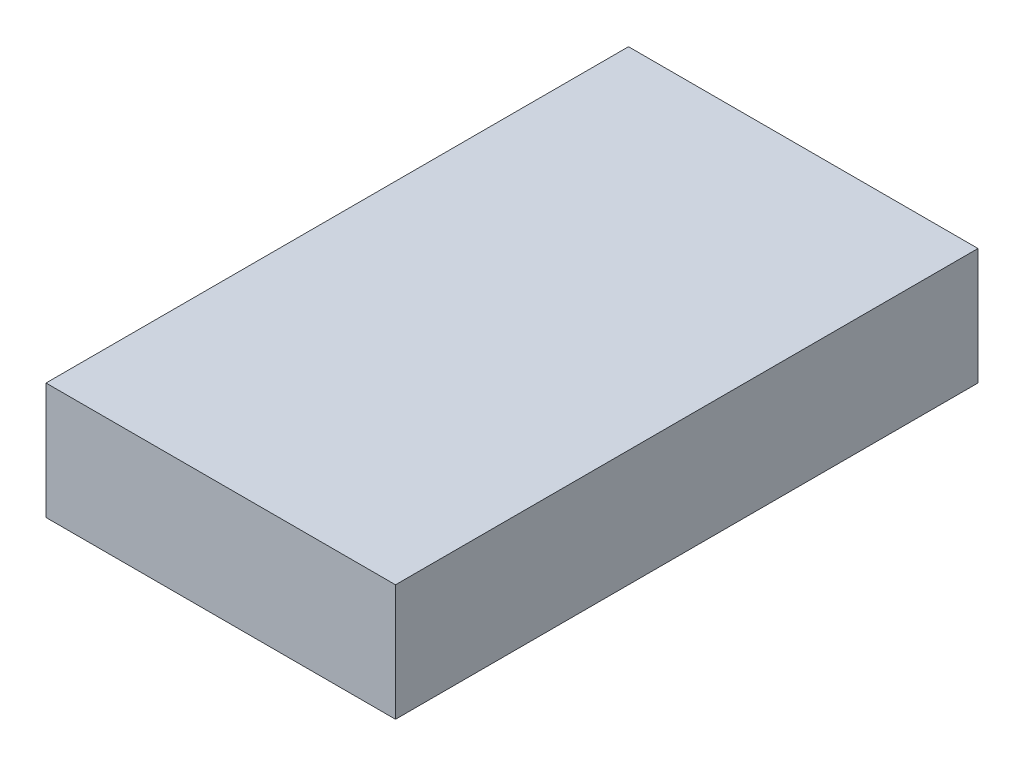
from build123d import *

# Parameters (mm, degrees)
SKETCH_1_W      = 150
SKETCH_1_H      = 250
EXTRUDE_1_DEPTH = 50


with BuildPart() as part:
    # 草图1 → 凸台-拉伸1 (new body)
    with BuildSketch(Plane(origin=(0, 0, 0), x_dir=(1, 0, 0), z_dir=(0, 1, 0))):
        Rectangle(SKETCH_1_W, SKETCH_1_H)
    extrude(amount=EXTRUDE_1_DEPTH)


solid = part.part
